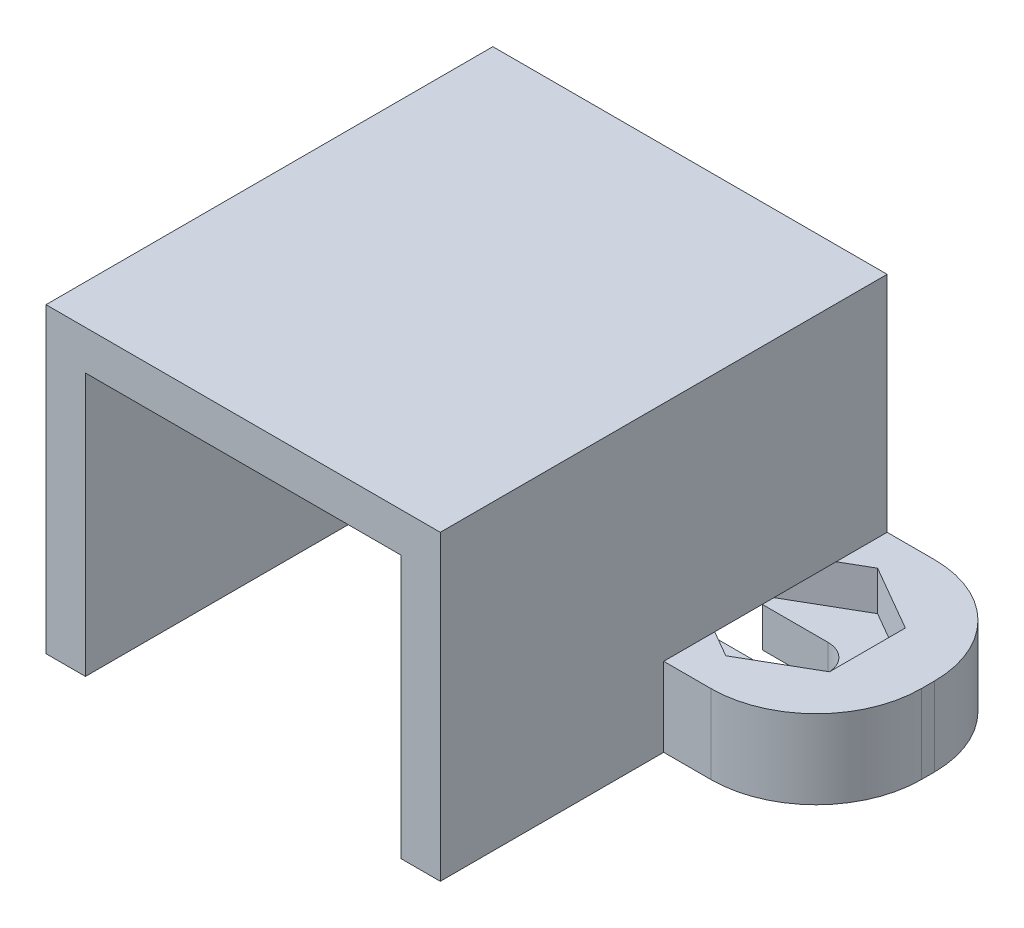
from build123d import *

# Parameters (mm, degrees)
BOSS_EXTRUDE1_DEPTH    = 17
SKETCH10_W             = 3
SKETCH10_H             = 4
SKETCH10_H_2           = 2
BOSS_EXTRUDE8_DEPTH    = 0.4
SKETCH11_W             = 2
SKETCH11_H             = 2.1
SKETCH11_W_2           = 4
BOSS_EXTRUDE9_DEPTH    = 0.4
FILLET5_R              = 0.4
SPLIT2_SURFACE_1_BACK  = 26.421
SPLIT2_SURFACE_1_DEPTH = 52.842
SPLIT2_SURFACE_2_BACK  = 26.421
SPLIT2_SURFACE_2_DEPTH = 52.842
FILLET6_R              = 1.5
SKETCH13_W             = 5.8
SKETCH13_H             = 8.5
BOSS_EXTRUDE10_DEPTH   = 3
FILLET7_R              = 4
SPLIT3_SURFACE_3_BACK  = 34.598
SPLIT3_SURFACE_3_DEPTH = 69.196
SPLIT3_SURFACE_4_BACK  = 34.598
SPLIT3_SURFACE_4_DEPTH = 69.196
CUT_EXTRUDE1_DEPTH     = 1.5
CUT_EXTRUDE2_DEPTH     = 29.664263465


with BuildPart() as part:
    # Sketch1 → Boss-Extrude1 (new body)
    with BuildSketch(Plane.XY):
        Polygon((0, 0), (1.5, 0), (1.5, 10), (13.5, 10), (13.5, 0), (15, 0), (15, 11.5), (0, 11.5), (0, 10), align=None)
    extrude(amount=BOSS_EXTRUDE1_DEPTH)

    # Sketch10 → Boss-Extrude8 (add)
    with BuildSketch(Plane.XZ.offset(-10)):
        with Locations((12, 14)):
            Rectangle(SKETCH10_W, SKETCH10_H)
        with Locations((12, 10)):
            Rectangle(SKETCH10_W, SKETCH10_H_2)
    extrude(amount=BOSS_EXTRUDE8_DEPTH)

    # Sketch11 → Boss-Extrude9 (add)
    with BuildSketch(Plane.ZY.offset(-13.5)):
        with Locations((10, 8.55)):
            Rectangle(SKETCH11_W, SKETCH11_H)
        with Locations((14, 8.55)):
            Rectangle(SKETCH11_W_2, SKETCH11_H)
    extrude(amount=BOSS_EXTRUDE9_DEPTH)

    # Fillet5
    fillet5_edges = [part.edges().sort_by_distance(p)[0] for p in [
        (13.1, 9.6, 14),
        (13.1, 9.6, 10),
    ]]
    fillet(fillet5_edges, radius=FILLET5_R)


with BuildPart() as body_2:
    # Split2: the piece behind the surface
    add(part.part)
    # Split2 surface: a surface, the sketch's curves swept straight by 52.842 mm
    with BuildLine(Plane.XZ.offset(-SPLIT2_SURFACE_1_BACK), mode=Mode.PRIVATE) as split2_surface_1_path:
        Line((15, 8), (0, 8))
    split2_surface_1 = Shell.extrude(split2_surface_1_path.wire(), (0 * SPLIT2_SURFACE_1_DEPTH, -1 * SPLIT2_SURFACE_1_DEPTH, 0 * SPLIT2_SURFACE_1_DEPTH))
    split(bisect_by=split2_surface_1, keep=Keep.BOTTOM)


with BuildPart() as part_1:
    add(part.part)

    # Split2: split by a surface, the side it looks to stays
    # Split2 surface: a surface, the sketch's curves swept straight by 52.842 mm
    with BuildLine(Plane.XZ.offset(-SPLIT2_SURFACE_2_BACK), mode=Mode.PRIVATE) as split2_surface_2_path:
        Line((15, 8), (0, 8))
    split2_surface_2 = Shell.extrude(split2_surface_2_path.wire(), (0 * SPLIT2_SURFACE_2_DEPTH, -1 * SPLIT2_SURFACE_2_DEPTH, 0 * SPLIT2_SURFACE_2_DEPTH))
    split(bisect_by=split2_surface_2, keep=Keep.TOP)

    # Fillet6
    fillet6_edges = [part_1.edges().sort_by_distance(p)[0] for p in [
        (1.5, 10, 4),
        (13.5, 10, 4),
    ]]
    fillet(fillet6_edges, radius=FILLET6_R)


with BuildPart() as body_2_1:
    add(body_2.part)

    # Combine2: union part
    add(part_1.part)

    # Sketch13 → Boss-Extrude10 (add)
    with BuildSketch(Plane.XZ):
        with Locations((-2.9, 4.25)):
            Rectangle(SKETCH13_W, SKETCH13_H)
        with Locations((17.9, 4.25)):
            Rectangle(SKETCH13_W, SKETCH13_H)
    extrude(amount=-BOSS_EXTRUDE10_DEPTH)

    # Fillet7
    fillet7_edges = [body_2_1.edges().sort_by_distance(p)[0] for p in [
        (20.8, 1.5, 8.5),
        (20.8, 1.5, 0),
        (-5.8, 1.5, 0),
        (-5.8, 1.5, 8.5),
    ]]
    fillet(fillet7_edges, radius=FILLET7_R)


with BuildPart() as body_2_2:
    # Split3: the piece behind the surface
    add(body_2_1.part)
    # Split3 surface: a surface, the sketch's curves swept straight by 69.196 mm
    with BuildLine(Plane.ZY.offset(-SPLIT3_SURFACE_3_BACK), mode=Mode.PRIVATE) as split3_surface_3_path:
        Line((0, 3), (17, 3))
    split3_surface_3 = Shell.extrude(split3_surface_3_path.wire(), (-1 * SPLIT3_SURFACE_3_DEPTH, 0 * SPLIT3_SURFACE_3_DEPTH, 0 * SPLIT3_SURFACE_3_DEPTH))
    split(bisect_by=split3_surface_3, keep=Keep.BOTTOM)

    # Sketch16 → Cut-Extrude1 (cut)
    with BuildSketch(Plane(origin=(0, 3, 0), x_dir=(1, 0, 0), z_dir=(0, 1, 0))):
        Polygon((-1, -7.136751346), (1.5, -5.693375673), (1.5, -2.806624327), (-1, -1.363248654), (-3.5, -2.806624327), (-3.5, -5.693375673), align=None)
        Polygon((16, -1.363248654), (13.5, -2.806624327), (13.5, -5.693375673), (16, -7.136751346), (18.5, -5.693375673), (18.5, -2.806624327), align=None)
    extrude(amount=-CUT_EXTRUDE1_DEPTH, mode=Mode.SUBTRACT)

    # Sketch17 → Cut-Extrude2 (cut, through all)
    with BuildSketch(Plane(origin=(0, 1.5, 0), x_dir=(1, 0, 0), z_dir=(0, 1, 0))):
        with BuildLine():
            Line((16, -5.25), (13.5, -5.25))
            Line((13.5, -5.25), (13.5, -3.25))
            Line((13.5, -3.25), (16, -3.25))
            ThreePointArc((16, -3.25), (17, -4.25), (16, -5.25))
        make_face()
        with BuildLine():
            Line((1.5, -3.25), (1.5, -5.25))
            Line((1.5, -5.25), (-1, -5.25))
            ThreePointArc((-1, -5.25), (-2, -4.25), (-1, -3.25))
            Line((-1, -3.25), (1.5, -3.25))
        make_face()
    extrude(amount=-CUT_EXTRUDE2_DEPTH, mode=Mode.SUBTRACT)


with BuildPart() as body_2_3:
    add(body_2_1.part)

    # Split3: split by a surface, the side it looks to stays
    # Split3 surface: a surface, the sketch's curves swept straight by 69.196 mm
    with BuildLine(Plane.ZY.offset(-SPLIT3_SURFACE_4_BACK), mode=Mode.PRIVATE) as split3_surface_4_path:
        Line((0, 3), (17, 3))
    split3_surface_4 = Shell.extrude(split3_surface_4_path.wire(), (-1 * SPLIT3_SURFACE_4_DEPTH, 0 * SPLIT3_SURFACE_4_DEPTH, 0 * SPLIT3_SURFACE_4_DEPTH))
    split(bisect_by=split3_surface_4, keep=Keep.TOP)

    # Combine3: union body 2 2
    add(body_2_2.part)


solid = body_2_3.part
